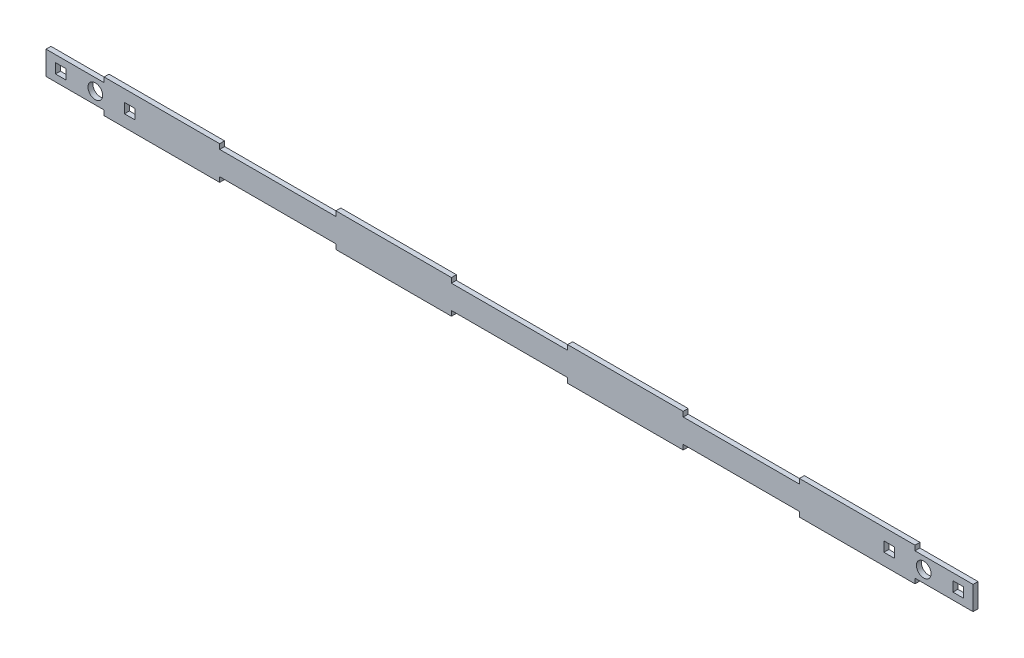
from build123d import *

# Parameters (mm, degrees)
ESQUISSE1_W             = 596.9
ESQUISSE1_H             = 21.59
BOSS_EXTRU_1_DEPTH      = 3.175
ESQUISSE4_W             = 74.8125
ESQUISSE4_H             = 3.18
ESQUISSE4_H_2           = 3.175
ESQUISSE4_W_2           = 37.40625
ENL_V_MAT_EXTRU_3_DEPTH = 299.662041696
ESQUISSE5_R             = 4.7244
ESQUISSE5_W             = 6.858
ESQUISSE5_H             = 6.35
ENL_V_MAT_EXTRU_4_DEPTH = 299.662041696


with BuildPart() as part:
    # Esquisse1 → Boss.-Extru.1 (new body)
    with BuildSketch(Plane.XY):
        Rectangle(ESQUISSE1_W, ESQUISSE1_H)
    extrude(amount=BOSS_EXTRU_1_DEPTH)

    # Esquisse4 → Enlèv. mat.-Extru.3 (cut, through all)
    with BuildSketch(Plane.XY.offset(3.175)):
        with Locations((0, 9.205)):
            Rectangle(ESQUISSE4_W, ESQUISSE4_H)
        with Locations((-149.225, 9.2075)):
            Rectangle(ESQUISSE4_W, ESQUISSE4_H_2)
        with Locations((-279.746875, 9.2075)):
            Rectangle(ESQUISSE4_W_2, ESQUISSE4_H_2)
        with Locations((279.746875, 9.2075)):
            Rectangle(ESQUISSE4_W_2, ESQUISSE4_H_2)
        with Locations((149.225, 9.2075)):
            Rectangle(ESQUISSE4_W, ESQUISSE4_H_2)
    enl_v_mat_extru_3 = extrude(amount=-ENL_V_MAT_EXTRU_3_DEPTH, mode=Mode.SUBTRACT)

    # Symétrie3: Enlèv. mat.-Extru.3 across plane
    add(enl_v_mat_extru_3.mirror(Plane.ZX), mode=Mode.SUBTRACT)

    # Esquisse5 → Enlèv. mat.-Extru.4 (cut, through all)
    with BuildSketch(Plane.XY.offset(3.175)):
        with Locations((-266.7, 0)):
            Circle(ESQUISSE5_R)
        with Locations((-244.475, 0)):
            Rectangle(ESQUISSE5_W, ESQUISSE5_H)
        with Locations((-288.925, 0)):
            Rectangle(ESQUISSE5_W, ESQUISSE5_H)
    enl_v_mat_extru_4 = extrude(amount=-ENL_V_MAT_EXTRU_4_DEPTH, mode=Mode.SUBTRACT)

    # Symétrie4: Enlèv. mat.-Extru.4 across plane
    add(enl_v_mat_extru_4.mirror(Plane(origin=(0, 0, 0), x_dir=(0, 0, 1), z_dir=(1, 0, 0))), mode=Mode.SUBTRACT)


solid = part.part
